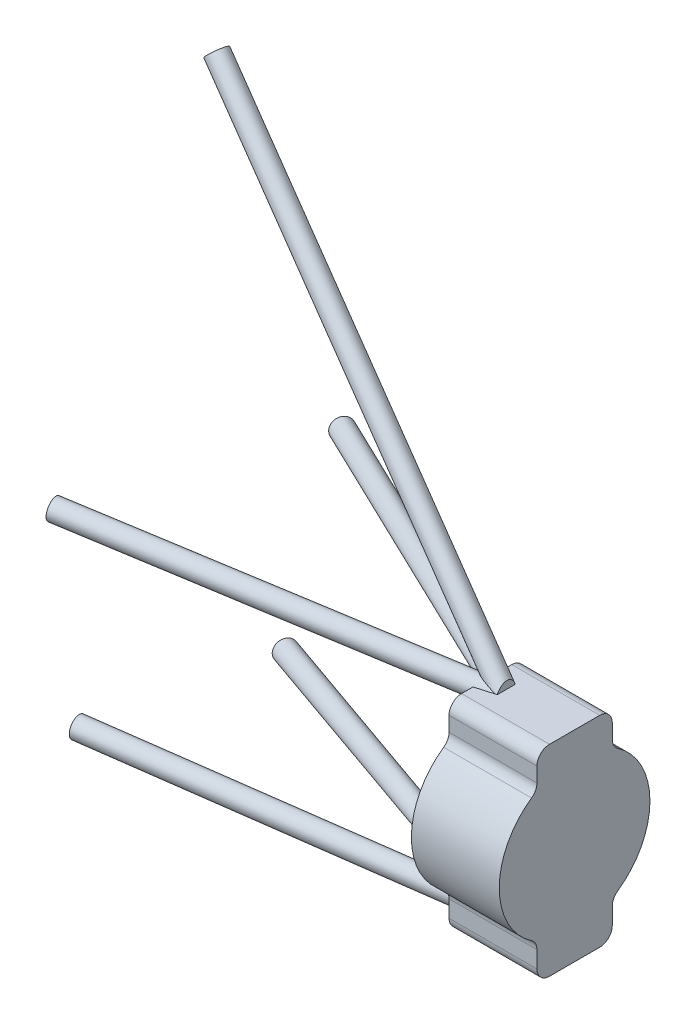
from build123d import *

# Parameters (mm, degrees)
SWEEP3_PROFILE_R    = 8
SWEEP4_PROFILE_R    = 8
SWEEP6_PROFILE_R    = 8
SKETCH80_W          = 50
SKETCH80_H          = 57.849509876
CUT_EXTRUDE1_DEPTH  = 300
SKETCH81_R          = 60
BOSS_EXTRUDE1_DEPTH = 70
FILLET1_R           = 10


with BuildPart() as part:
    # Sweep3: sweep along a curve in space
    with BuildLine() as sweep3_path:
        Line((480, 230, -590), (190, 190, -750))
        Line((480, 230, -590), (190, 250, -520))
    # Sweep3 profile (on start of the path) → Sweep3 (sweep)
    with BuildSketch(Plane(origin=(190, 250, -520), x_dir=(0.2346405331038965, 0, 0.9720822085732871), z_dir=(0.9699050900314443, -0.06689000620906493, -0.23411502173172755))):
        Circle(SWEEP3_PROFILE_R)
    sweep(path=sweep3_path.line, transition=Transition.RIGHT)

    # Sweep4: sweep along a curve in space
    with BuildLine() as sweep4_path:
        Line((480, 230, -590), (190, 500, -650))
    # Sweep4 profile (on start of the path) → Sweep4 (sweep)
    with BuildSketch(Plane(origin=(480, 230, -590), x_dir=(-0.6814185279188429, -0.7318939744313498, 0), z_dir=(-0.7236444363336271, 0.6737379234830321, -0.1497195385517849))):
        Circle(SWEEP4_PROFILE_R)
    sweep(path=sweep4_path.line)


with BuildPart() as body_2:
    # Sweep6: sweep along a curve in space
    with BuildLine() as sweep6_path:
        Line((480, 80, -590), (190, 90, -539.058512789))
        Line((480, 80, -590), (190, 60, -704.548891224))
    # Sweep6 profile (on start of the path) → Sweep6 (sweep)
    with BuildSketch(Plane(origin=(190, 60, -704.548891224), x_dir=(-0.3673752090170087, 0, 0.9300728228476033), z_dir=(0.9281653987551736, 0.0640114068107016, 0.3666217837932773))):
        Circle(SWEEP6_PROFILE_R)
    sweep(path=sweep6_path.line, transition=Transition.RIGHT)


with BuildPart() as cut_extrude1_tool:
    # Sketch80 → Cut-Extrude1 (new body)
    with BuildSketch(Plane(origin=(0, 0, 0), x_dir=(1, 0, 0), z_dir=(0, 1, 0))):
        with Locations((505, 590.170010545)):
            Rectangle(SKETCH80_W, SKETCH80_H)
    extrude(amount=CUT_EXTRUDE1_DEPTH)


with BuildPart() as part_1:
    add(part.part)

    # Cut-Extrude1: cut by cut_extrude1_tool
    add(cut_extrude1_tool.part, mode=Mode.SUBTRACT)

    # Sketch81 → Boss-Extrude1 (add)
    with BuildSketch(Plane(origin=(465, 0, 0), x_dir=(0, 0, -1), z_dir=(1, 0, 0))):
        with Locations((590, 155.874728278)):
            Circle(SKETCH81_R)
        with BuildLine():
            Line((620, 235), (560, 235))
            Line((560, 235), (560, 207.836252505))
            ThreePointArc((560, 207.836252505), (590, 215.874728278), (620, 207.836252505))
            Line((620, 207.836252505), (620, 235))
        make_face()
        with BuildLine():
            ThreePointArc((620, 103.91320405), (590, 95.874728278), (560, 103.91320405))
            Line((560, 103.91320405), (560, 75))
            Line((560, 75), (620, 75))
            Line((620, 75), (620, 103.91320405))
        make_face()
    extrude(amount=BOSS_EXTRUDE1_DEPTH)

    # Fillet1
    fillet1_edges = [part_1.edges().sort_by_distance(p)[0] for p in [
        (500, 235, -620),
        (500, 103.91320405, -620),
        (500, 207.836252505, -620),
        (500, 235, -560),
        (500, 207.836252505, -560),
        (500, 103.91320405, -560),
        (500, 75, -560),
        (500, 75, -620),
    ]]
    fillet(fillet1_edges, radius=FILLET1_R)


with BuildPart() as body_2_1:
    add(body_2.part)

    # Cut-Extrude1: cut by cut_extrude1_tool
    add(cut_extrude1_tool.part, mode=Mode.SUBTRACT)


with BuildPart() as part_2:
    add(part_1.part)

    # Combine1: union body 2
    add(body_2_1.part)


with BuildPart() as part_3:
    # Body-Move/Copy1: moved
    add(part_2.part.moved(Location((0, 46, 0))))


solid = part_3.part
